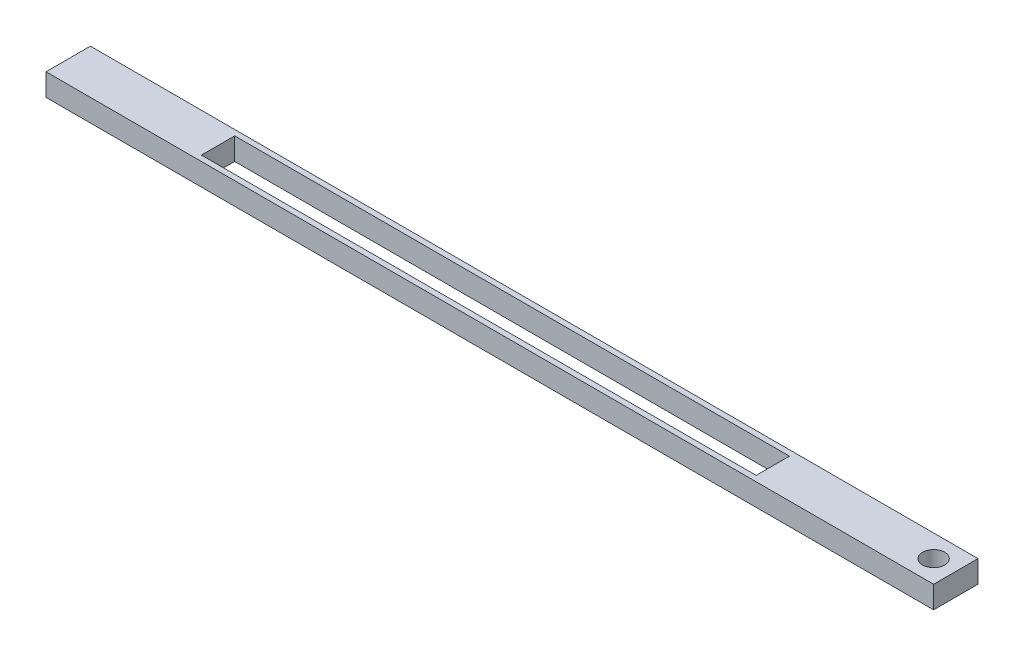
from build123d import *

# Parameters (mm, degrees)
SKETCH_1_W          = 400
SKETCH_1_H          = 10
EXTRUDE_1_DEPTH     = 20
SKETCH_2_W          = 250
SKETCH_2_H          = 15
CUT_EXTRUDE_1_DEPTH = 20
SKETCH_4_R          = 5
CUT_EXTRUDE_3_DEPTH = 20


with BuildPart() as part:
    # Эскиз1 → Бобышка-Вытянуть1 (new body)
    with BuildSketch(Plane.XY):
        Rectangle(SKETCH_1_W, SKETCH_1_H)
    extrude(amount=EXTRUDE_1_DEPTH)

    # Эскиз2 → Вырез-Вытянуть1 (cut)
    with BuildSketch(Plane(origin=(0, 5, 0), x_dir=(1, 0, 0), z_dir=(0, 1, 0))):
        with Locations((-7.463718673, -10)):
            Rectangle(SKETCH_2_W, SKETCH_2_H)
    extrude(amount=-CUT_EXTRUDE_1_DEPTH, mode=Mode.SUBTRACT)

    # Эскиз4 → Вырез-Вытянуть3 (cut)
    with BuildSketch(Plane(origin=(0, 5, 0), x_dir=(1, 0, 0), z_dir=(0, 1, 0))):
        with Locations(Location((190, -10, 0), (0, 0, 270))):
            Circle(SKETCH_4_R)
    extrude(amount=-CUT_EXTRUDE_3_DEPTH, mode=Mode.SUBTRACT)


solid = part.part
